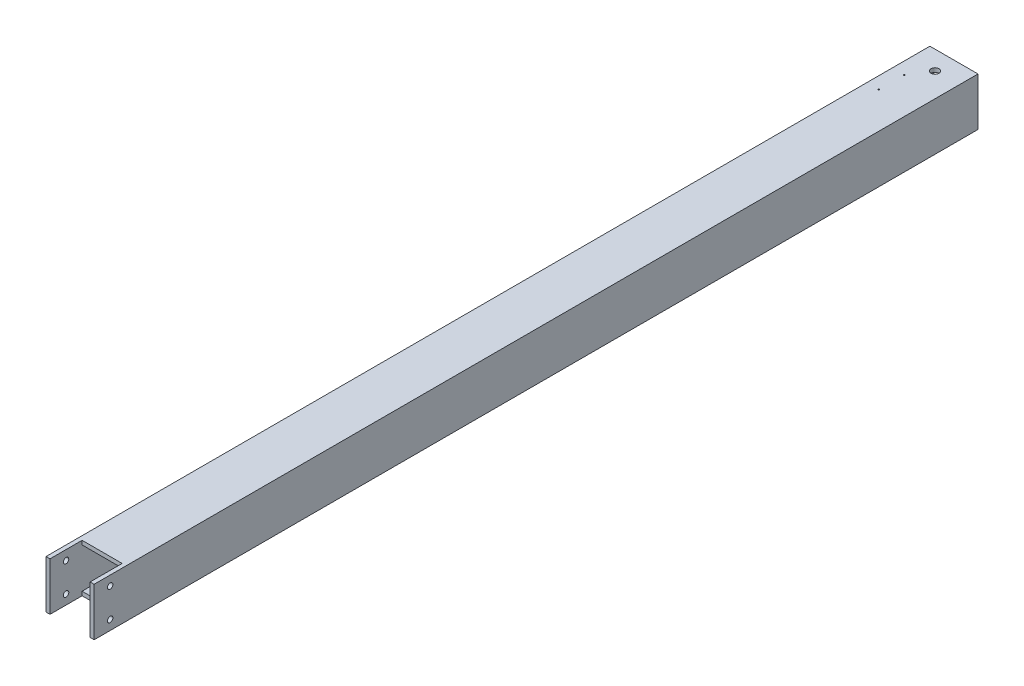
from build123d import *

# Parameters (mm, degrees)
ESQUISSE2_W             = 38.1
ESQUISSE2_H             = 38.1
ESQUISSE2_W_2           = 31.75
ESQUISSE2_H_2           = 31.75
BOSS_EXTRU_1_DEPTH      = 350
ESQUISSE3_R             = 2.159
ENL_V_MAT_EXTRU_1_DEPTH = 353.582632159
ESQUISSE4_W             = 31.75
ESQUISSE4_H             = 25.4
ENL_V_MAT_EXTRU_2_DEPTH = 353.582632159
ESQUISSE6_R             = 3.175
ENL_V_MAT_EXTRU_3_DEPTH = 353.582632159
ESQUISSE8_R             = 0.5
ENL_V_MAT_EXTRU_4_DEPTH = 352.035332979
ESQUISSE8_3_R           = 0.5
ENL_V_MAT_EXTRU_5_DEPTH = 352.035332979


with BuildPart() as part:
    # Esquisse2 → Boss.-Extru.1 (new, symmetric)
    with BuildSketch(Plane.XY):
        Rectangle(ESQUISSE2_W, ESQUISSE2_H)
        Rectangle(ESQUISSE2_W_2, ESQUISSE2_H_2, mode=Mode.SUBTRACT)
    extrude(amount=BOSS_EXTRU_1_DEPTH, both=True)

    # Esquisse3 → Enlèv. mat.-Extru.1 (cut, through all)
    with BuildSketch(Plane.ZY.offset(19.05)):
        with Locations((337.3, -11.43)):
            Circle(ESQUISSE3_R)
    enl_v_mat_extru_1 = extrude(amount=-ENL_V_MAT_EXTRU_1_DEPTH, mode=Mode.SUBTRACT)

    # Symétrie1: Enlèv. mat.-Extru.1 across plane
    add(enl_v_mat_extru_1.mirror(Plane.ZX), mode=Mode.SUBTRACT)

    # Esquisse4 → Enlèv. mat.-Extru.2 (cut, through all)
    with BuildSketch(Plane.XZ.offset(19.05)):
        with Locations((0, 337.3)):
            Rectangle(ESQUISSE4_W, ESQUISSE4_H)
    extrude(amount=-ENL_V_MAT_EXTRU_2_DEPTH, mode=Mode.SUBTRACT)

    # Esquisse6 → Enlèv. mat.-Extru.3 (cut, through all)
    with BuildSketch(Plane.XZ.offset(19.05)):
        with Locations((0, -335)):
            Circle(ESQUISSE6_R)
    extrude(amount=-ENL_V_MAT_EXTRU_3_DEPTH, mode=Mode.SUBTRACT)

    # Esquisse8 → Enlèv. mat.-Extru.4 (cut, through all)
    with BuildSketch(Plane(origin=(0, 0, 0), x_dir=(1, 0, 0), z_dir=(0, 1, 0))):
        with Locations((9.525, 320)):
            Circle(ESQUISSE8_R)
        with Locations((9.525, 300)):
            Circle(ESQUISSE8_R)
    extrude(amount=-ENL_V_MAT_EXTRU_4_DEPTH, mode=Mode.SUBTRACT)

    # Esquisse8<3> → Enlèv. mat.-Extru.5 (cut, through all)
    with BuildSketch(Plane(origin=(0, 0, 0), x_dir=(1, 0, 0), z_dir=(0, 1, 0))):
        with Locations((-9.525, 300)):
            Circle(ESQUISSE8_3_R)
        with Locations((-9.525, 320)):
            Circle(ESQUISSE8_3_R)
    extrude(amount=ENL_V_MAT_EXTRU_5_DEPTH, mode=Mode.SUBTRACT)


solid = part.part
